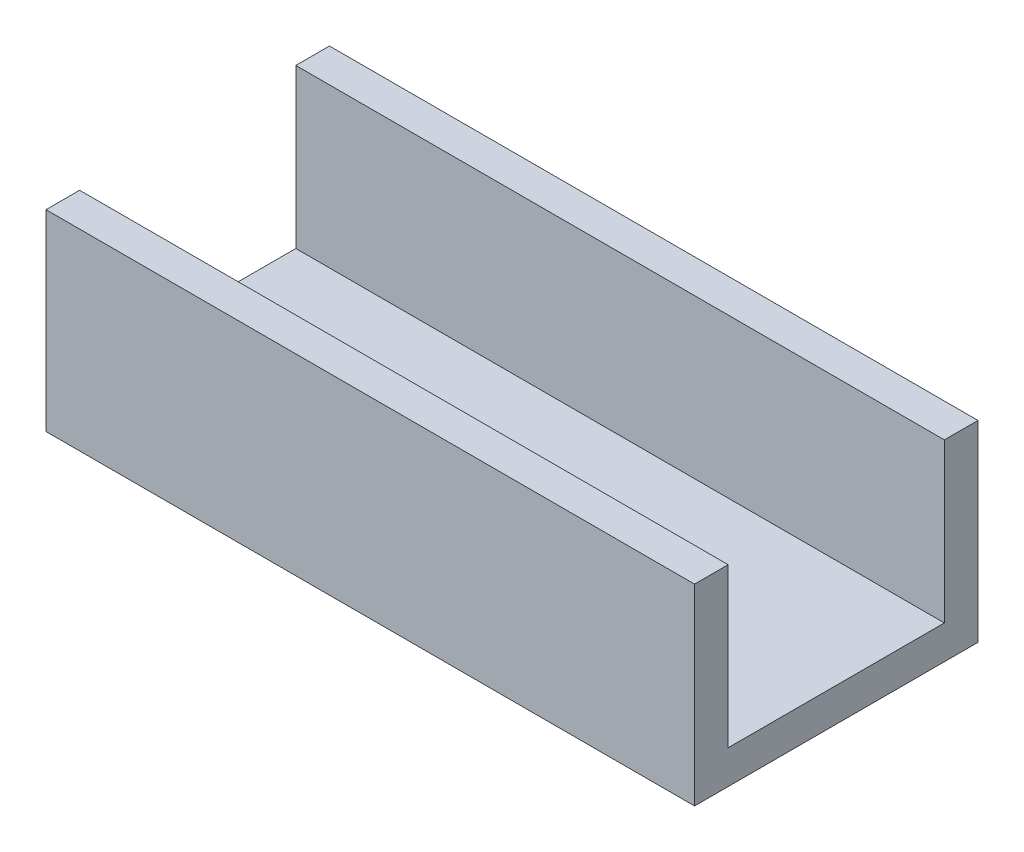
from build123d import *

# Parameters (mm, degrees)
SKETCH_1_W      = 27
SKETCH_1_H      = 11.8
BOTTOM_DEPTH    = 1.4
SKETCH_1_3_W    = 27
SKETCH_1_3_H    = 1.4
EXTRUDE_2_DEPTH = 8


with BuildPart() as part:
    # Эскиз1 → Bottom (new body)
    with BuildSketch(Plane(origin=(0, 0, 0), x_dir=(1, 0, 0), z_dir=(0, 1, 0))):
        with Locations((13.5, 5.9)):
            Rectangle(SKETCH_1_W, SKETCH_1_H)
    extrude(amount=BOTTOM_DEPTH)

    # Эскиз1<3> → Бобышка-Вытянуть2 (add)
    with BuildSketch(Plane(origin=(0, 0, 0), x_dir=(1, 0, 0), z_dir=(0, 1, 0))):
        with Locations((13.5, 11.1)):
            Rectangle(SKETCH_1_3_W, SKETCH_1_3_H)
        with Locations((13.5, 0.7)):
            Rectangle(SKETCH_1_3_W, SKETCH_1_3_H)
    extrude(amount=EXTRUDE_2_DEPTH)


solid = part.part
